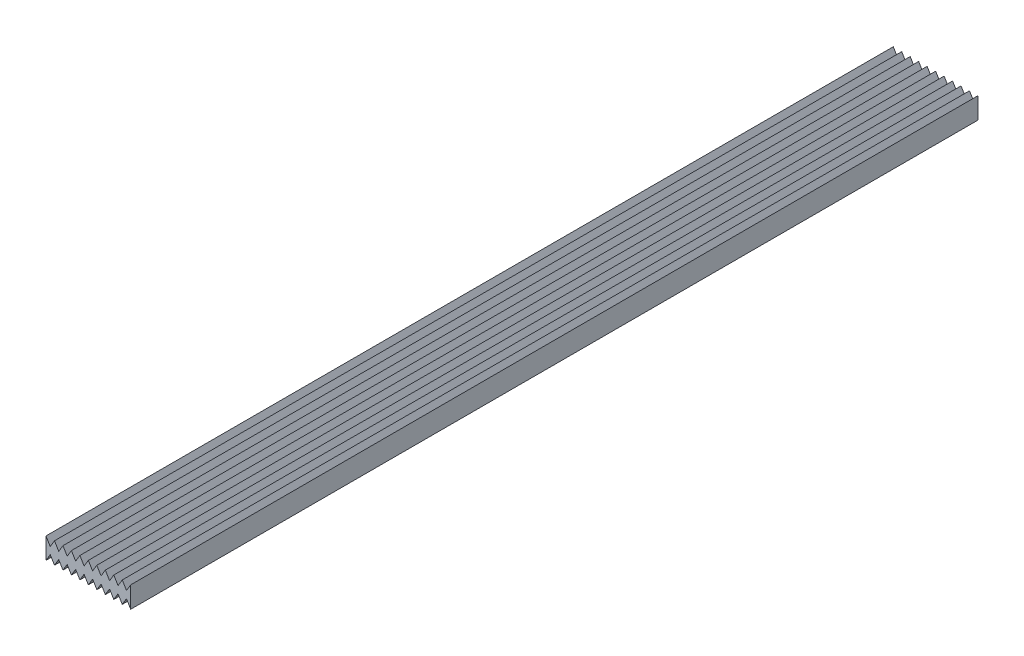
from build123d import *

# Parameters (mm, degrees)
BOSS_EXTRUDE1_DEPTH = 300


with BuildPart() as part:
    # Sketch1 → Boss-Extrude1 (new, symmetric)
    with BuildSketch(Plane.XY):
        Polygon((-30, 7.5), (-30, -7.5), (-27, -2.5), (-24, -7.5), (-21, -2.5), (-18, -7.5), (-15, -2.5), (-12, -7.5), (-9, -2.5), (-6, -7.5), (-3, -2.5), (0, -7.5), (3, -2.5), (6, -7.5), (9, -2.5), (12, -7.5), (15, -2.5), (18, -7.5), (21, -2.5), (24, -7.5), (27, -2.5), (30, -7.5), (30, 7.5), (27, 2.5), (24, 7.5), (21, 2.5), (18, 7.5), (15, 2.5), (12, 7.5), (9, 2.5), (6, 7.5), (3, 2.5), (0, 7.5), (-3, 2.5), (-6, 7.5), (-9, 2.5), (-12, 7.5), (-15, 2.5), (-18, 7.5), (-21, 2.5), (-24, 7.5), (-27, 2.5), align=None)
    extrude(amount=BOSS_EXTRUDE1_DEPTH, both=True)


solid = part.part
